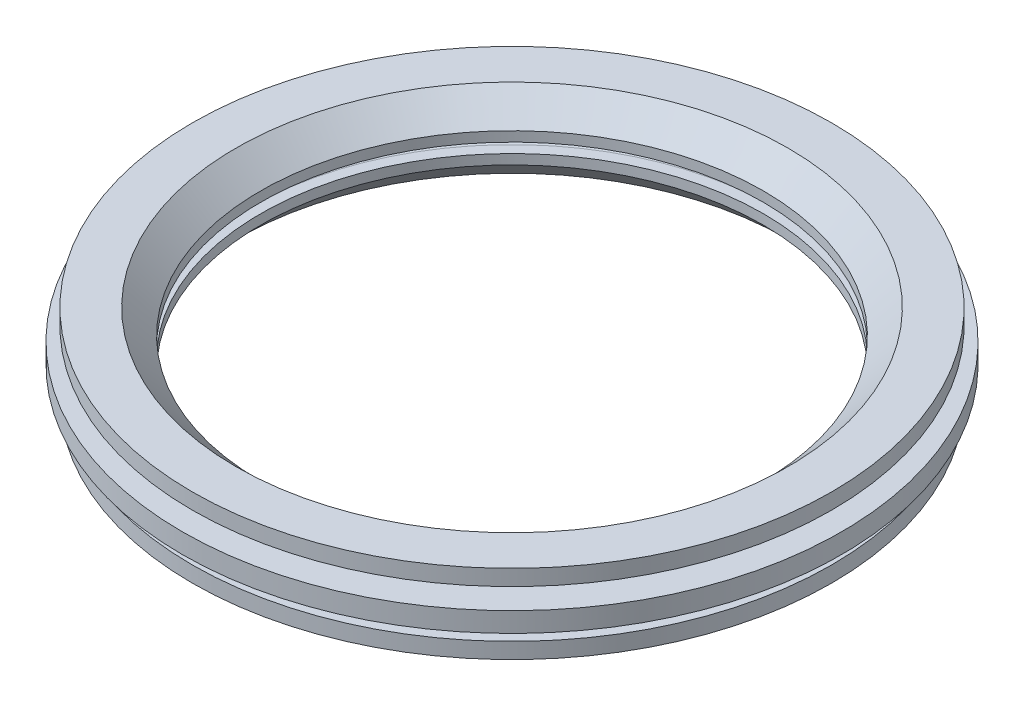
from build123d import *


with BuildPart() as part:
    # Sketch1 → Revolve1 (revolve)
    with BuildSketch(Plane.XY, mode=Mode.PRIVATE) as revolve1_sk:
        with BuildLine():
            Line((40.386, 0.79375), (40.386, 2.38125))
            Line((40.386, 2.38125), (44.35475, 6.35))
            Line((44.35475, 6.35), (51.3715, 6.35))
            Line((51.3715, 6.35), (51.3715, 3.81))
            Line((51.3715, 3.81), (46.2915, 3.81))
            Line((46.2915, 3.81), (46.2915, 1.5875))
            Line((46.2915, 1.5875), (52.959, 1.5875))
            Line((52.959, 1.5875), (52.959, 0))
            Line((52.959, 0), (42.926, 0))
            ThreePointArc((42.926, 0), (42.693516008, 0.561266008), (42.13225, 0.79375))
            Line((42.13225, 0.79375), (40.386, 0.79375))
        make_face()
    revolve1 = revolve(revolve1_sk.sketch.rotate(Axis((0, 0, 0), (0, 1, 0)), 90), axis=Axis((0, 0, 0), (0, 1, 0)))

    # Mirror1: Revolve1 across plane
    add(revolve1.mirror(Plane.ZX))


solid = part.part
